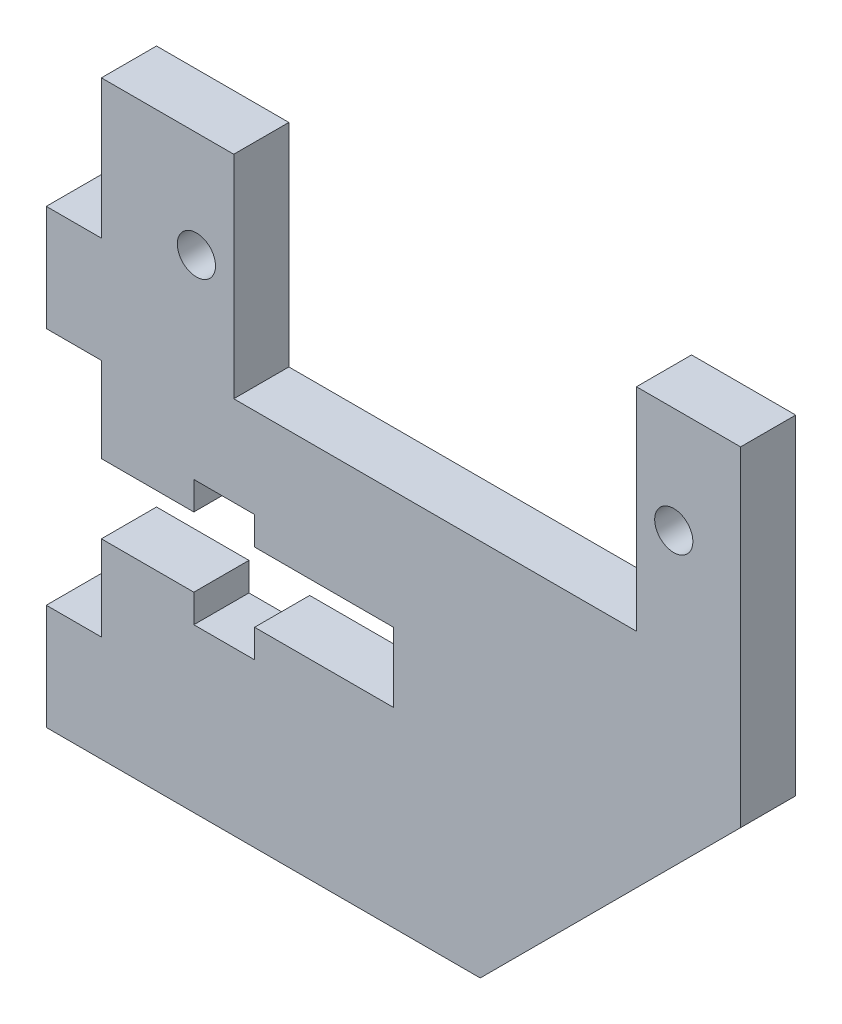
from build123d import *

# Parameters (mm, degrees)
SKETCH1_R           = 1.1
BOSS_EXTRUDE1_DEPTH = 3.175
CHAMFER1_SIZE       = 15


with BuildPart() as part:
    # Sketch1 → Boss-Extrude1 (new body)
    # profile 1 of 2: a face of its own
    with BuildSketch(Plane.XY):
        Polygon((10.8, 21.8), (10.8, 34), (3.175, 34), (3.175, 26), (0, 26), (0, 19.9), (3.175, 19.9), (3.175, 17), (40, 17), (40, 34), (34, 34), (34, 21.8), align=None)
        with Locations((8.65, 27.9)):
            Circle(SKETCH1_R, mode=Mode.SUBTRACT)
        with Locations((36.15, 27.9)):
            Circle(SKETCH1_R, mode=Mode.SUBTRACT)
    # profile 2 of 2: a face of its own
    with BuildSketch(Plane.XY):
        Polygon((40, 0), (40, 17), (3.175, 17), (3.175, 15), (8.5, 15), (8.5, 16.625), (12, 16.625), (12, 15), (20, 15), (20, 11), (12, 11), (12, 9.375), (8.5, 9.375), (8.5, 11), (3.175, 11), (3.175, 6.1), (0, 6.1), (0, 0), align=None)
    extrude(amount=BOSS_EXTRUDE1_DEPTH)

    # Chamfer1
    chamfer1_edges = [part.edges().sort_by_distance(p)[0] for p in [
        (40, 0, 1.5875),
    ]]
    chamfer(chamfer1_edges, length=CHAMFER1_SIZE)


solid = part.part
